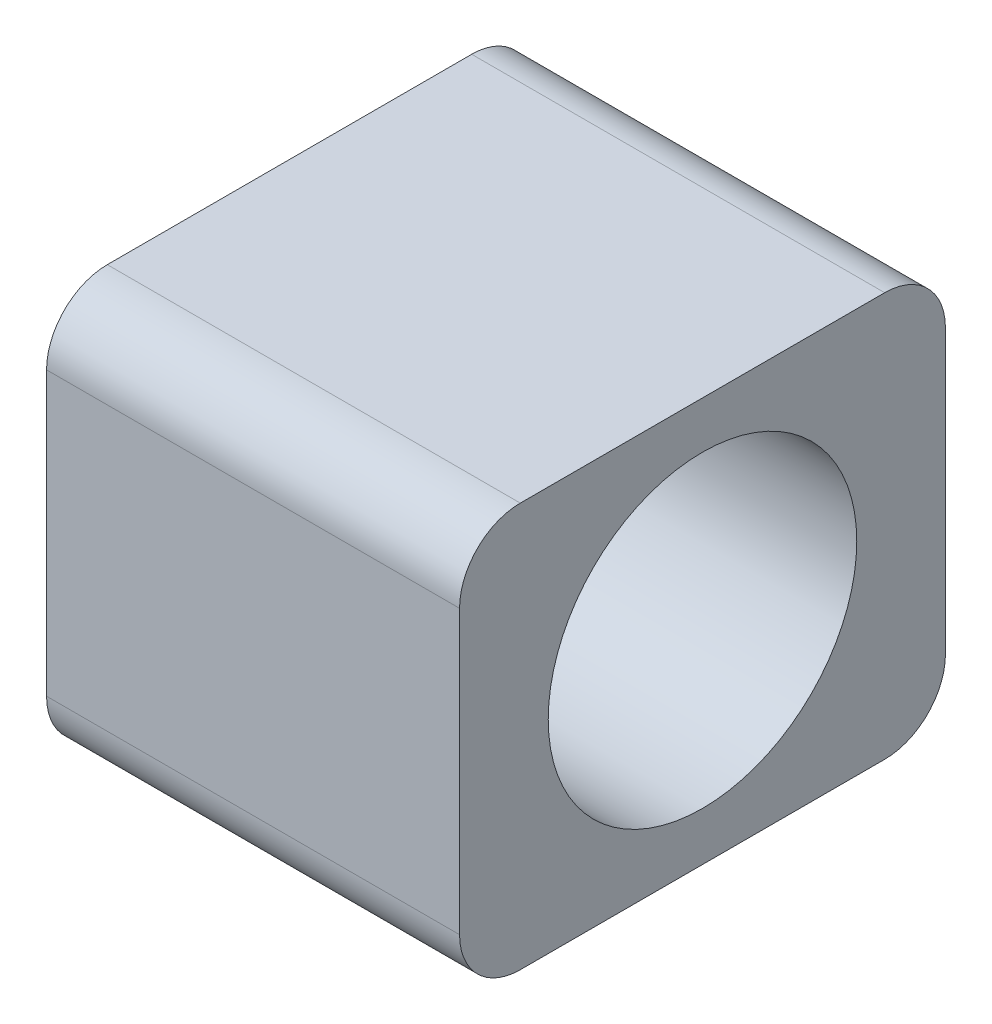
from build123d import *

# Parameters (mm, degrees)
SKETCH1_R           = 12.7
BOSS_EXTRUDE1_DEPTH = 17


with BuildPart() as part:
    # Sketch1 → Boss-Extrude1 (new, symmetric)
    with BuildSketch(Plane(origin=(0, 0, 0), x_dir=(0, 0, -1), z_dir=(1, 0, 0))):
        with BuildLine():
            Line((-15, -16.7), (15, -16.7))
            ThreePointArc((15, -16.7), (18.535533906, -15.235533906), (20, -11.7))
            Line((20, -11.7), (20, 11.569))
            ThreePointArc((20, 11.569), (18.535533906, 15.104533906), (15, 16.569))
            Line((15, 16.569), (-15, 16.569))
            ThreePointArc((-15, 16.569), (-18.535533906, 15.104533906), (-20, 11.569))
            Line((-20, 11.569), (-20, -11.7))
            ThreePointArc((-20, -11.7), (-18.535533906, -15.235533906), (-15, -16.7))
        make_face()
        Circle(SKETCH1_R, mode=Mode.SUBTRACT)
    extrude(amount=BOSS_EXTRUDE1_DEPTH, both=True)


solid = part.part
